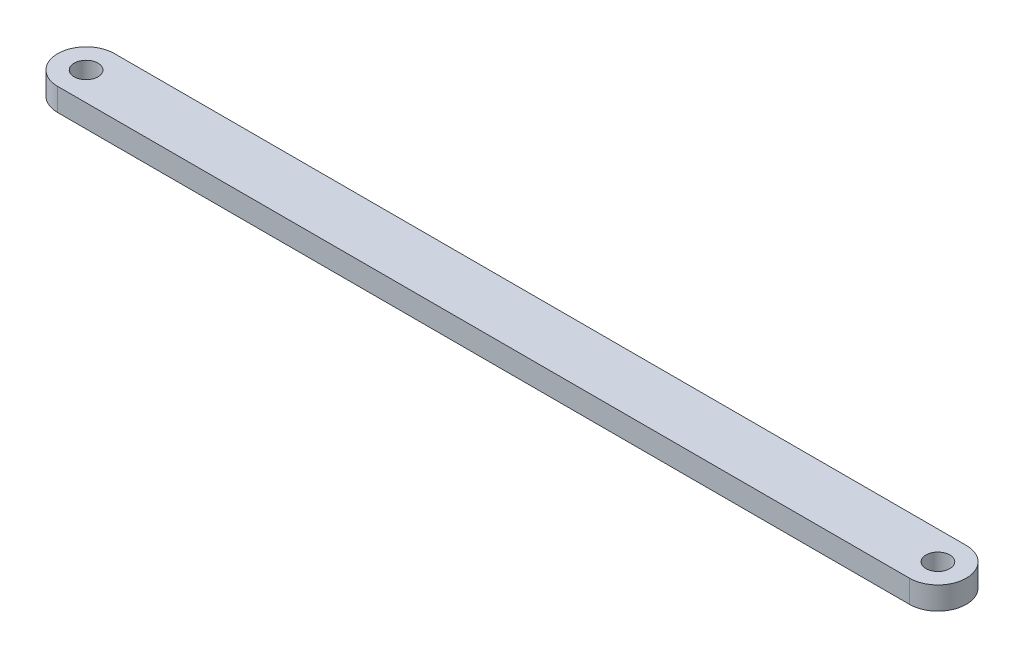
from build123d import *

# Parameters (mm, degrees)
SKETCH1_R           = 1.05
BOSS_EXTRUDE1_DEPTH = 2


with BuildPart() as part:
    # Sketch1 → Boss-Extrude1 (new body)
    with BuildSketch(Plane(origin=(0, 0, 0), x_dir=(1, 0, 0), z_dir=(0, 1, 0))):
        with BuildLine():
            Line((0, 2.5), (75, 2.5))
            ThreePointArc((75, 2.5), (77.5, 0), (75, -2.5))
            Line((75, -2.5), (0, -2.5))
            ThreePointArc((0, -2.5), (-2.5, 0), (0, 2.5))
        make_face()
        with Locations(Location((0, 0, 0), (0, 0, 270))):
            Circle(SKETCH1_R, mode=Mode.SUBTRACT)
        with Locations(Location((75, 0, 0), (0, 0, 270))):
            Circle(SKETCH1_R, mode=Mode.SUBTRACT)
    extrude(amount=BOSS_EXTRUDE1_DEPTH)


solid = part.part
